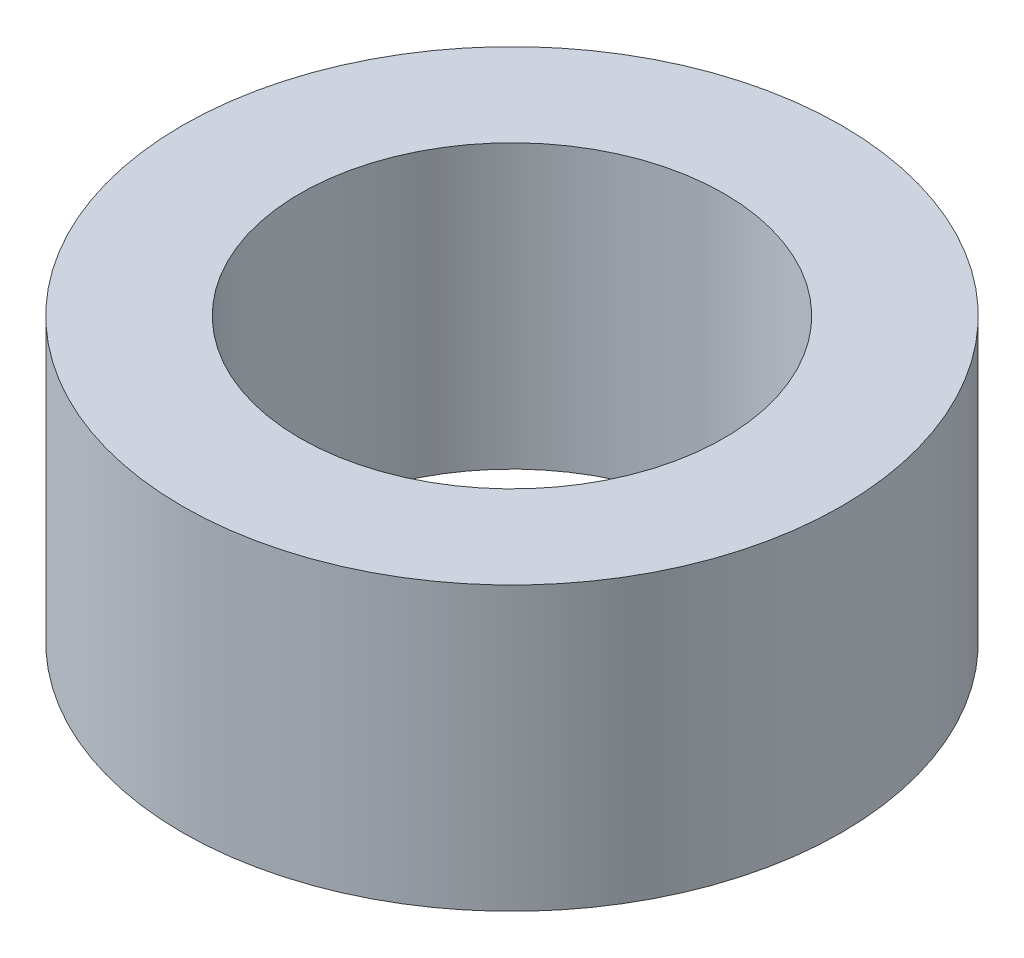
from build123d import *

# Parameters (mm, degrees)
SKETCH_1_R      = 3.5
SKETCH_1_R_2    = 2.25
EXTRUDE_1_DEPTH = 3


with BuildPart() as part:
    # 草图1 → 凸台-拉伸1 (new body)
    with BuildSketch(Plane(origin=(0, 0, 0), x_dir=(1, 0, 0), z_dir=(0, 1, 0))):
        with Locations(Location((0, 0, 0), (0, 0, 270))):
            Circle(SKETCH_1_R)
        with Locations(Location((0, 0, 0), (0, 0, 270))):
            Circle(SKETCH_1_R_2, mode=Mode.SUBTRACT)
    extrude(amount=EXTRUDE_1_DEPTH)


solid = part.part
